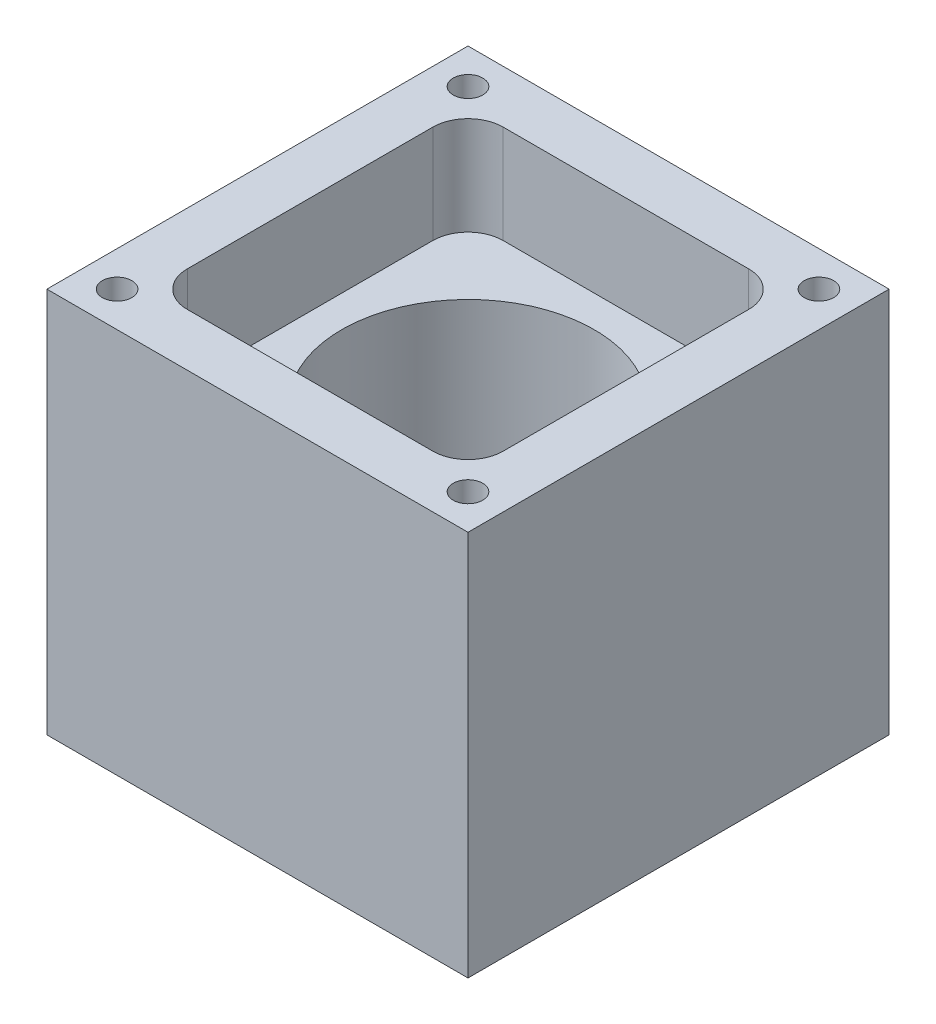
from build123d import *

# Parameters (mm, degrees)
SKETCH1_W           = 60
SKETCH1_H           = 60
BOSS_EXTRUDE1_DEPTH = 55
SKETCH2_R           = 18
CUT_EXTRUDE1_DEPTH  = 70.462219947
M5_TAPPED_HOLE1_D   = 4.2
SKETCH5_W           = 45
SKETCH5_H           = 45
CUT_EXTRUDE2_DEPTH  = 14
FILLET1_R           = 5


with BuildPart() as part:
    # Sketch1 → Boss-Extrude1 (new body)
    with BuildSketch(Plane(origin=(0, 0, 0), x_dir=(1, 0, 0), z_dir=(0, 1, 0))):
        Rectangle(SKETCH1_W, SKETCH1_H)
    extrude(amount=BOSS_EXTRUDE1_DEPTH)

    # Sketch2 → Cut-Extrude1 (cut, through all)
    with BuildSketch(Plane(origin=(0, 55, 0), x_dir=(1, 0, 0), z_dir=(0, 1, 0))):
        with Locations(Location((0, 0, 0), (0, 0, 270))):
            Circle(SKETCH2_R)
    extrude(amount=-CUT_EXTRUDE1_DEPTH, mode=Mode.SUBTRACT)

    # M5 Tapped Hole1 (through all)
    with Locations(Plane(origin=(0, 55, 0), x_dir=(1, 0, 0), z_dir=(0, 1, 0))):
        with Locations((-25, -25), (-25, 25), (25, 25), (25, -25), (0, 0)):
            Hole(M5_TAPPED_HOLE1_D / 2)

    # Sketch5 → Cut-Extrude2 (cut)
    with BuildSketch(Plane(origin=(0, 55, 0), x_dir=(1, 0, 0), z_dir=(0, 1, 0))):
        Rectangle(SKETCH5_W, SKETCH5_H)
    extrude(amount=-CUT_EXTRUDE2_DEPTH, mode=Mode.SUBTRACT)

    # Fillet1
    fillet1_edges = [part.edges().sort_by_distance(p)[0] for p in [
        (-22.5, 48, 22.5),
        (-22.5, 48, -22.5),
        (22.5, 48, -22.5),
        (22.5, 48, 22.5),
    ]]
    fillet(fillet1_edges, radius=FILLET1_R)


solid = part.part
